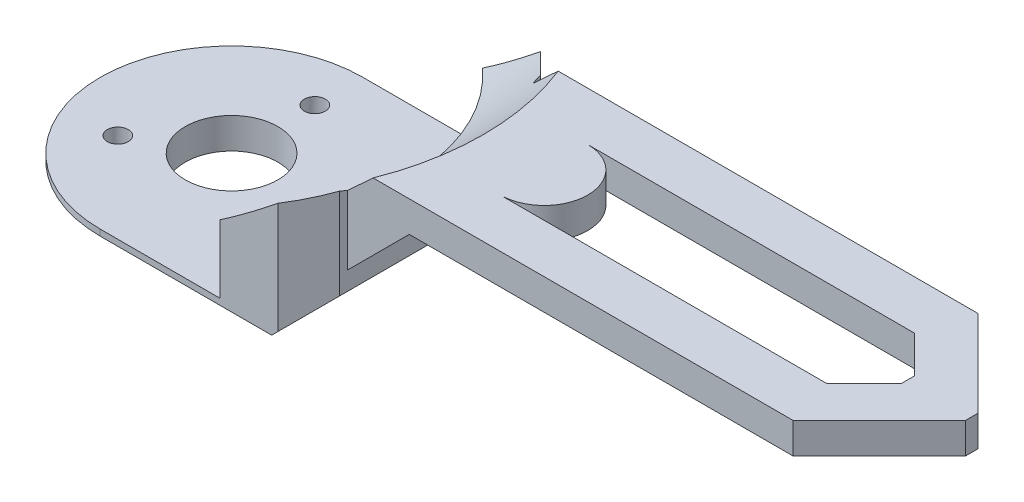
from build123d import *

# Parameters (mm, degrees)
SKETCH_1_R          = 1.7
SKETCH_1_R_2        = 7.5
EXTRUDE_1_DEPTH     = 5
EXTRUDE_2_DEPTH     = 23
SKETCH_4_W          = 30
SKETCH_4_H          = 5
EXTRUDE_3_DEPTH     = 86.2
CHAMFER_1_SIZE      = 10
CHAMFER_2_SIZE      = 10
CHAMFER_3_SIZE      = 14
CHAMFER_5_SIZE      = 12
CHAMFER_6_SIZE      = 5
CUT_EXTRUDE_2_DEPTH = 14
CHAMFER_7_SIZE      = 6
CHAMFER_8_SIZE      = 4


with BuildPart() as part:
    # 草图1 → 凸台-拉伸1 (new body)
    with BuildSketch(Plane(origin=(0, 0, 0), x_dir=(1, 0, 0), z_dir=(0, 1, 0))):
        with BuildLine():
            Line((33.8, 21.3), (33.8, -21.3))
            Line((33.8, -21.3), (28.8, -21.3))
            Line((28.8, -21.3), (0, -21.3))
            ThreePointArc((0, -21.3), (-21.3, 0), (0, 21.3))
            Line((0, 21.3), (28.8, 21.3))
            Line((28.8, 21.3), (33.8, 21.3))
        make_face()
        with Locations(Location((0, 13.5, 0), (0, 0, 270))):
            Circle(SKETCH_1_R, mode=Mode.SUBTRACT)
        with Locations(Location((11.691342951, -6.75, 0), (0, 0, 270))):
            Circle(SKETCH_1_R, mode=Mode.SUBTRACT)
        with Locations(Location((-11.691342951, -6.75, 0), (0, 0, 270))):
            Circle(SKETCH_1_R, mode=Mode.SUBTRACT)
        with Locations(Location((0, 0, 0), (0, 0, 270))):
            Circle(SKETCH_1_R_2, mode=Mode.SUBTRACT)
    extrude(amount=EXTRUDE_1_DEPTH)

    # 草图3 → 凸台-拉伸2 (add)
    with BuildSketch(Plane(origin=(0, 5, 0), x_dir=(1, 0, 0), z_dir=(0, 1, 0))):
        with BuildLine():
            Line((33.8, 21.3), (19.384271975, 21.3))
            ThreePointArc((19.384271975, 21.3), (28.8, 0), (19.384271975, -21.3))
            Line((19.384271975, -21.3), (33.8, -21.3))
            Line((33.8, -21.3), (33.8, 21.3))
        make_face()
    extrude(amount=EXTRUDE_2_DEPTH)

    # 草图4 → 凸台-拉伸3 (add)
    with BuildSketch(Plane(origin=(33.8, 0, 0), x_dir=(0, 0, -1), z_dir=(1, 0, 0))):
        with Locations((0, 25.5)):
            Rectangle(SKETCH_4_W, SKETCH_4_H)
    extrude(amount=EXTRUDE_3_DEPTH)

    # 倒角1
    chamfer_1_edges = [part.edges().sort_by_distance(p)[0] for p in [
        (33.8, 23, 0),
    ]]
    chamfer(chamfer_1_edges, length=CHAMFER_1_SIZE)

    # 倒角2
    chamfer_2_edges = [part.edges().sort_by_distance(p)[0] for p in [
        (33.8, 0, 0),
    ]]
    chamfer(chamfer_2_edges, length=CHAMFER_2_SIZE)

    # 倒角3
    chamfer_3_edges = [part.edges().sort_by_distance(p)[0] for p in [
        (120, 25.5, -15),
        (120, 25.5, 15),
    ]]
    chamfer(chamfer_3_edges, length=CHAMFER_3_SIZE)

    # 倒角5
    chamfer_5_edges = [part.edges().sort_by_distance(p)[0] for p in [
        (28.8, 28, 0),
    ]]
    chamfer(chamfer_5_edges, length=CHAMFER_5_SIZE)

    # 倒角6
    chamfer_6_edges = [part.edges().sort_by_distance(p)[0] for p in [
        (33.8, 18.575797856, 21.3),
        (33.8, 18.575797856, -21.3),
    ]]
    chamfer(chamfer_6_edges, length=CHAMFER_6_SIZE)

    # 草图6 → 切除-拉伸2 (cut)
    with BuildSketch(Plane(origin=(0, 28, 0), x_dir=(1, 0, 0), z_dir=(0, 1, 0))):
        with BuildLine():
            Line((50.652646896, 7.091102625), (109.617699283, 7.091102625))
            Line((109.617699283, 7.091102625), (109.617699283, -7.091102625))
            Line((109.617699283, -7.091102625), (50.652646896, -7.091102625))
            ThreePointArc((50.652646896, -7.091102625), (57.743749521, 0), (50.652646896, 7.091102625))
        make_face()
    extrude(amount=-CUT_EXTRUDE_2_DEPTH, mode=Mode.SUBTRACT)

    # 倒角7
    chamfer_7_edges = [part.edges().sort_by_distance(p)[0] for p in [
        (109.617699283, 25.5, -7.091102625),
        (109.617699283, 25.5, 7.091102625),
    ]]
    chamfer(chamfer_7_edges, length=CHAMFER_7_SIZE)

    # 倒角8
    chamfer_8_edges = [part.edges().sort_by_distance(p)[0] for p in [
        (11.9, 0, 21.3),
        (-21.3, 0, 0),
        (11.9, 0, -21.3),
    ]]
    chamfer(chamfer_8_edges, length=CHAMFER_8_SIZE)


solid = part.part
